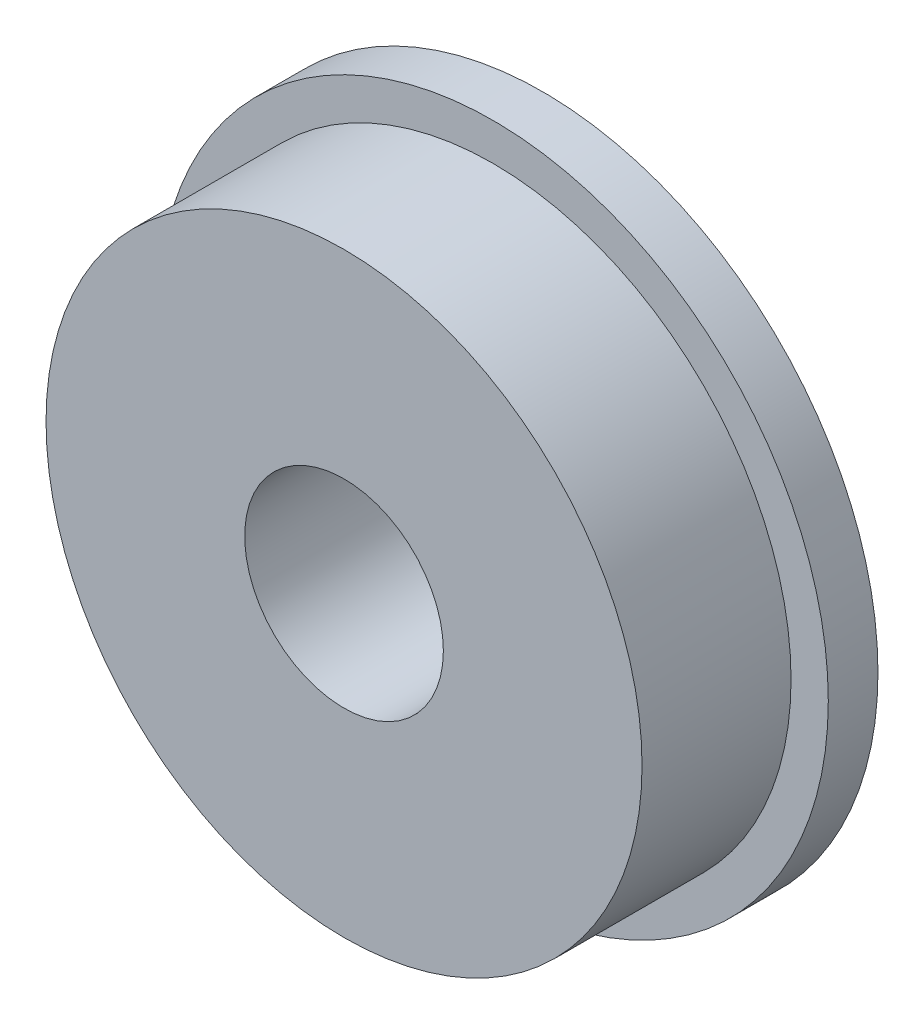
from build123d import *

# Parameters (mm, degrees)
SKETCH1_R           = 6.75
SKETCH1_R_2         = 2
BOSS_EXTRUDE1_DEPTH = 4
CUT_EXTRUDE1_START  = -3
SKETCH2_R           = 6.75
SKETCH2_R_2         = 6
CUT_EXTRUDE1_DEPTH  = 3


with BuildPart() as part:
    # Sketch1 → Boss-Extrude1 (new body)
    with BuildSketch(Plane.XY):
        Circle(SKETCH1_R)
        Circle(SKETCH1_R_2, mode=Mode.SUBTRACT)
    extrude(amount=BOSS_EXTRUDE1_DEPTH)

    # Sketch2 → Cut-Extrude1 (cut)
    with BuildSketch(Plane.XY.offset(4).offset(CUT_EXTRUDE1_START)):
        Circle(SKETCH2_R)
        Circle(SKETCH2_R_2, mode=Mode.SUBTRACT)
    extrude(amount=CUT_EXTRUDE1_DEPTH, mode=Mode.SUBTRACT)


solid = part.part
